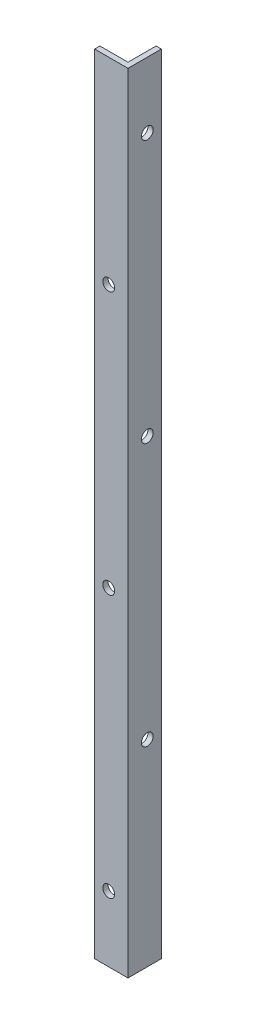
from build123d import *

# Parameters (mm, degrees)
BOSS_EXTRUDE1_DEPTH = 300
SKETCH2_R           = 2.25
CUT_EXTRUDE1_DEPTH  = 10
SKETCH3_R           = 2.25
CUT_EXTRUDE2_DEPTH  = 10


with BuildPart() as part:
    # Sketch1 → Boss-Extrude1 (new body)
    with BuildSketch(Plane(origin=(0, 0, 0), x_dir=(1, 0, 0), z_dir=(0, 1, 0))):
        Polygon((-12.7, 0), (0, 0), (0, 12.7), (-2, 12.7), (-2, 2), (-12.7, 2), align=None)
    extrude(amount=BOSS_EXTRUDE1_DEPTH)

    # Sketch2 → Cut-Extrude1 (cut)
    with BuildSketch(Plane.ZY.offset(2)):
        with Locations((-7.35, 275)):
            Circle(SKETCH2_R)
        with Locations((-7.35, 175)):
            Circle(SKETCH2_R)
        with Locations((-7.35, 75)):
            Circle(SKETCH2_R)
    extrude(amount=-CUT_EXTRUDE1_DEPTH, mode=Mode.SUBTRACT)

    # Sketch3 → Cut-Extrude2 (cut)
    with BuildSketch(Plane(origin=(0, 0, -2), x_dir=(-1, 0, 0), z_dir=(0, 0, -1))):
        with Locations((7.35, 225)):
            Circle(SKETCH3_R)
        with Locations((7.35, 125)):
            Circle(SKETCH3_R)
        with Locations((7.35, 25)):
            Circle(SKETCH3_R)
    extrude(amount=-CUT_EXTRUDE2_DEPTH, mode=Mode.SUBTRACT)


solid = part.part
